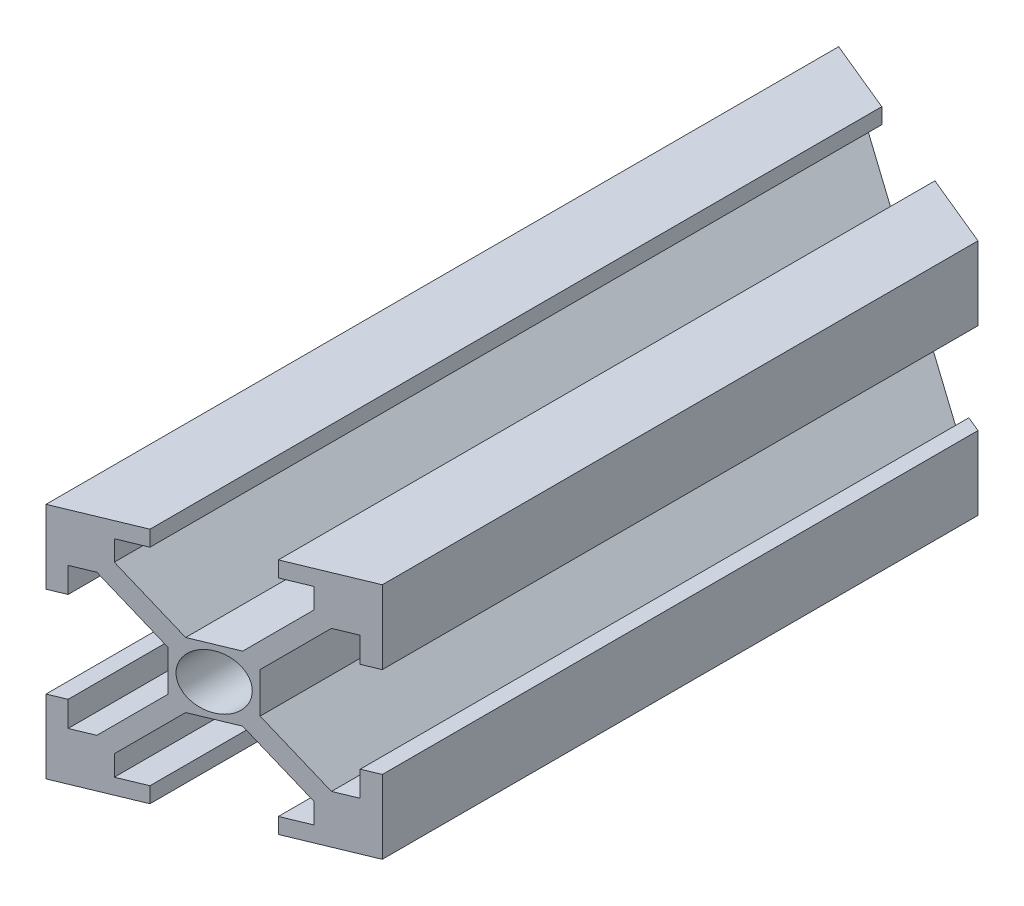
from build123d import *

# Parameters (mm, degrees)
SKETCH3_R           = 3.4
BOSS_EXTRUDE1_DEPTH = 100
CUT_EXTRUDE1_DEPTH  = 38
CUT_EXTRUDE2_DEPTH  = 38


with BuildPart() as part:
    # Sketch3 → Boss-Extrude1 (new body)
    with BuildSketch(Plane.XY):
        Polygon((-4.1, 2.544365081), (-4.1, -2.544365081), (-10.463961031, -8.908326112), (-13.02814489, -8.908326112), (-13.02814489, -5.726345597), (-15, -5.726345597), (-15, -15), (-5.726345597, -15), (-5.726345597, -13.02814489), (-8.908326112, -13.02814489), (-8.908326112, -10.463961031), (-2.544365081, -4.1), (2.544365081, -4.1), (8.908326112, -10.463961031), (8.908326112, -13.02814489), (5.726345597, -13.02814489), (5.726345597, -15), (15, -15), (15, -5.726345597), (13.02814489, -5.726345597), (13.02814489, -8.908326112), (10.463961031, -8.908326112), (4.1, -2.544365081), (4.1, 2.544365081), (10.463961031, 8.908326112), (13.02814489, 8.908326112), (13.02814489, 5.726345597), (15, 5.726345597), (15, 15), (5.726345597, 15), (5.726345597, 13.02814489), (8.908326112, 13.02814489), (8.908326112, 10.463961031), (2.544365081, 4.1), (-2.544365081, 4.1), (-8.908326112, 10.463961031), (-8.908326112, 13.02814489), (-5.726345597, 13.02814489), (-5.726345597, 15), (-15, 15), (-15, 5.726345597), (-13.02814489, 5.726345597), (-13.02814489, 8.908326112), (-10.463961031, 8.908326112), align=None)
        Circle(SKETCH3_R, mode=Mode.SUBTRACT)
    extrude(amount=BOSS_EXTRUDE1_DEPTH)

    # Sketch4 → Cut-Extrude1 (cut)
    with BuildSketch(Plane(origin=(0, 15, 0), x_dir=(1, 0, 0), z_dir=(0, 1, 0))):
        Polygon((-15, -100), (15, -100), (15, -87.573593129), align=None)
    extrude(amount=-CUT_EXTRUDE1_DEPTH, mode=Mode.SUBTRACT)

    # Sketch5 → Cut-Extrude2 (cut)
    with BuildSketch(Plane(origin=(0, 15, 0), x_dir=(1, 0, 0), z_dir=(0, 1, 0))):
        Polygon((-15, 0), (15, 0), (15, -12.426406871), align=None)
    extrude(amount=-CUT_EXTRUDE2_DEPTH, mode=Mode.SUBTRACT)


solid = part.part
